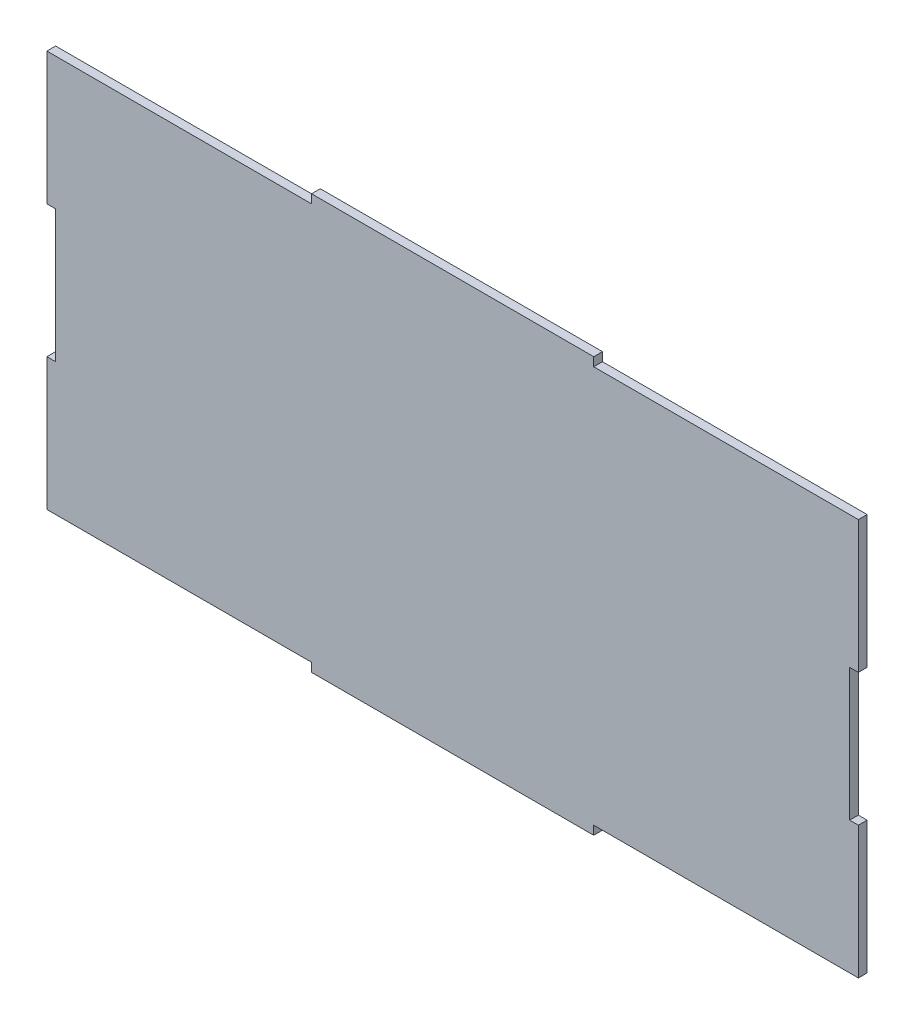
from build123d import *

# Parameters (mm, degrees)
SALIENTE_EXTRUIR1_DEPTH = 3.3


with BuildPart() as part:
    # Croquis1 → Saliente-Extruir1 (new body)
    with BuildSketch(Plane.XY):
        Polygon((-153.3, -25), (-153.3, -75), (-53.3, -75), (-53.3, -78.3), (53.3, -78.3), (53.3, -75), (153.3, -75), (153.3, -25), (150, -25), (150, 25), (153.3, 25), (153.3, 75), (53.3, 75), (53.3, 78.3), (-53.3, 78.3), (-53.3, 75), (-153.3, 75), (-153.3, 25), (-150, 25), (-150, -25), align=None)
    extrude(amount=SALIENTE_EXTRUIR1_DEPTH)


solid = part.part
